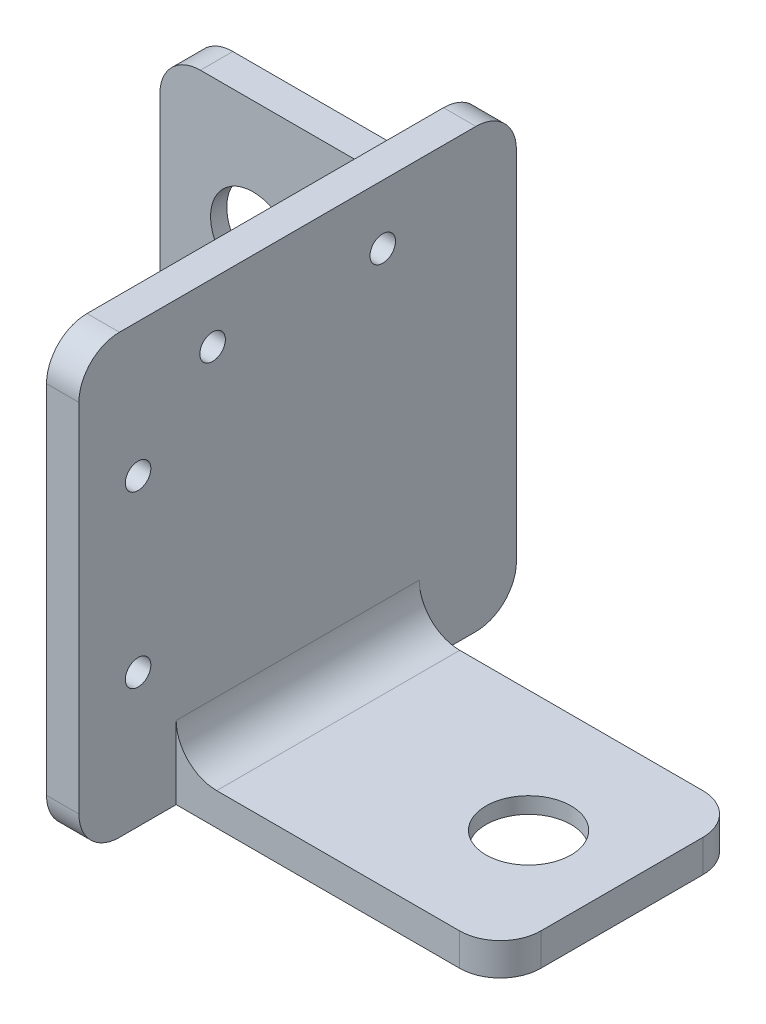
from build123d import *

# Parameters (mm, degrees)
SKETCH1_W            = 54
SKETCH1_H            = 54
BOSS_EXTRUDE1_DEPTH  = 4
FILLET1_R            = 5
SKETCH2_W            = 30
SKETCH2_H            = 4
BOSS_EXTRUDE2_DEPTH  = 3
SKETCH3_W            = 30
SKETCH3_H            = 4
BOSS_EXTRUDE3_DEPTH  = 37
SKETCH4_W            = 4
SKETCH4_H            = 30.000186299
BOSS_EXTRUDE6_DEPTH  = 3
SKETCH6_W            = 4
SKETCH6_H            = 30.000186299
BOSS_EXTRUDE7_DEPTH  = 33
FILLET2_R            = 5
SKETCH7_R            = 1.25
CUT_EXTRUDE1_DEPTH   = 75.706090782
SKETCH8_R            = 1.25
CUT_EXTRUDE2_DEPTH   = 75.706090782
SKETCH9_R            = 1.575
CUT_EXTRUDE3_DEPTH   = 56.299186251
SKETCH10_R           = 1.575
CUT_EXTRUDE4_DEPTH   = 56.299186251
FILLET6_R            = 5
SKETCH11_R           = 1.575
CUT_EXTRUDE5_DEPTH   = 59.258046655
SKETCH12_R           = 1.575
CUT_EXTRUDE6_DEPTH   = 33
BOSS_EXTRUDE10_DEPTH = 30
SKETCH15_R           = 11
CUT_EXTRUDE7_DEPTH   = 2
SKETCH16_R           = 5.25
CUT_EXTRUDE8_DEPTH   = 2
SKETCH17_R           = 11
CUT_EXTRUDE9_DEPTH   = 2
SKETCH18_R           = 5.25
CUT_EXTRUDE10_DEPTH  = 2


with BuildPart() as part:
    # Sketch1 → Boss-Extrude1 (new body)
    with BuildSketch(Plane(origin=(0, 0, 0), x_dir=(0, 0, -1), z_dir=(1, 0, 0))):
        Rectangle(SKETCH1_W, SKETCH1_H)
    extrude(amount=BOSS_EXTRUDE1_DEPTH)

    # Fillet1
    fillet1_edges = [part.edges().sort_by_distance(p)[0] for p in [
        (2, -27, -27),
        (2, -27, 27),
        (2, 27, 27),
        (2, 27, -27),
    ]]
    fillet(fillet1_edges, radius=FILLET1_R)

    # Sketch2 → Boss-Extrude2 (add)
    with BuildSketch(Plane(origin=(4, 0, 0), x_dir=(0, 0, -1), z_dir=(1, 0, 0))):
        with Locations((0.003473607, -25)):
            Rectangle(SKETCH2_W, SKETCH2_H)
    extrude(amount=BOSS_EXTRUDE2_DEPTH)

    # Sketch3 → Boss-Extrude3 (add)
    with BuildSketch(Plane(origin=(7, 0, 0), x_dir=(0, 0, -1), z_dir=(1, 0, 0))):
        with Locations((0.003473607, -25)):
            Rectangle(SKETCH3_W, SKETCH3_H)
    extrude(amount=BOSS_EXTRUDE3_DEPTH)

    # Sketch4 → Boss-Extrude6 (add)
    with BuildSketch(Plane.ZY):
        with Locations((-25, 0.003724222)):
            Rectangle(SKETCH4_W, SKETCH4_H)
    extrude(amount=BOSS_EXTRUDE6_DEPTH)

    # Sketch6 → Boss-Extrude7 (add)
    with BuildSketch(Plane.ZY.offset(3)):
        with Locations((-25, 0.003724222)):
            Rectangle(SKETCH6_W, SKETCH6_H)
    extrude(amount=BOSS_EXTRUDE7_DEPTH)

    # Fillet2
    fillet2_edges = [part.edges().sort_by_distance(p)[0] for p in [
        (44, -25, 14.996526393),
        (44, -25, -15.003473607),
        (-36, -14.996368927, -25),
        (-36, 15.003817372, -25),
    ]]
    fillet(fillet2_edges, radius=FILLET2_R)

    # Sketch7 → Cut-Extrude1 (cut, through all)
    with BuildSketch(Plane(origin=(0, 0, -27), x_dir=(-1, 0, 0), z_dir=(0, 0, -1))):
        with Locations((24.5, 0)):
            Circle(SKETCH7_R)
    extrude(amount=-CUT_EXTRUDE1_DEPTH, mode=Mode.SUBTRACT)

    # Sketch8 → Cut-Extrude2 (cut, through all)
    with BuildSketch(Plane(origin=(0, -27, 0), x_dir=(-1, 0, 0), z_dir=(0, -1, 0))):
        with Locations(Location((-32.5, 0, 0), (0, 0, 90))):
            Circle(SKETCH8_R)
    extrude(amount=-CUT_EXTRUDE2_DEPTH, mode=Mode.SUBTRACT)

    # Sketch9 → Cut-Extrude3 (cut, through all)
    with BuildSketch(Plane(origin=(4, 0, 0), x_dir=(0, 0, -1), z_dir=(1, 0, 0))):
        with Locations((-10.5, 19.7)):
            Circle(SKETCH9_R)
    extrude(amount=-CUT_EXTRUDE3_DEPTH, mode=Mode.SUBTRACT)

    # Sketch10 → Cut-Extrude4 (cut, through all)
    with BuildSketch(Plane(origin=(4, 0, 0), x_dir=(0, 0, -1), z_dir=(1, 0, 0))):
        with Locations((10.5, 19.7)):
            Circle(SKETCH10_R)
    extrude(amount=-CUT_EXTRUDE4_DEPTH, mode=Mode.SUBTRACT)

    # Fillet6
    fillet6_edges = [part.edges().sort_by_distance(p)[0] for p in [
        (4, -23, -0.003473607),
    ]]
    fillet(fillet6_edges, radius=FILLET6_R)

    # Sketch11 → Cut-Extrude5 (cut, through all)
    with BuildSketch(Plane.ZY):
        with Locations((19.7, 10.5)):
            Circle(SKETCH11_R)
    extrude(amount=-CUT_EXTRUDE5_DEPTH, mode=Mode.SUBTRACT)

    # Sketch12 → Cut-Extrude6 (cut)
    with BuildSketch(Plane.ZY):
        with Locations((19.7, -10.5)):
            Circle(SKETCH12_R)
    extrude(amount=-CUT_EXTRUDE6_DEPTH, mode=Mode.SUBTRACT)

    # Sketch14 → Boss-Extrude10 (add)
    with BuildSketch(Plane(origin=(0, -14.996368927, 0), x_dir=(-1, 0, 0), z_dir=(0, -1, 0))):
        with BuildLine():
            Line((6.771773058, 23), (0, 23))
            Line((0, 23), (0, 17.043091053))
            add(Edge.make_bspline(
                [(0, 17.043091053), (0.522042102, 20.003738935), (3.432344379, 22.411168624), (6.771773058, 23)],
                knots=[0, 0, 0, 0, 1, 1, 1, 1], degree=3))
        make_face()
    extrude(amount=-BOSS_EXTRUDE10_DEPTH)

    # Sketch15 → Cut-Extrude7 (cut)
    with BuildSketch(Plane(origin=(0, -27, 0), x_dir=(-1, 0, 0), z_dir=(0, -1, 0))):
        with Locations(Location((-32.5, 0, 0), (0, 0, 90))):
            Circle(SKETCH15_R)
    extrude(amount=-CUT_EXTRUDE7_DEPTH, mode=Mode.SUBTRACT)

    # Sketch16 → Cut-Extrude8 (cut)
    with BuildSketch(Plane(origin=(0, -23, 0), x_dir=(1, 0, 0), z_dir=(0, 1, 0))):
        with Locations(Location((32.5, 0, 0), (0, 0, 270))):
            Circle(SKETCH16_R)
    extrude(amount=-CUT_EXTRUDE8_DEPTH, mode=Mode.SUBTRACT)

    # Sketch17 → Cut-Extrude9 (cut)
    with BuildSketch(Plane(origin=(0, 0, -27), x_dir=(-1, 0, 0), z_dir=(0, 0, -1))):
        with Locations((24.5, 0)):
            Circle(SKETCH17_R)
    extrude(amount=-CUT_EXTRUDE9_DEPTH, mode=Mode.SUBTRACT)

    # Sketch18 → Cut-Extrude10 (cut)
    with BuildSketch(Plane.XY.offset(-23)):
        with Locations((-24.5, 0)):
            Circle(SKETCH18_R)
    extrude(amount=-CUT_EXTRUDE10_DEPTH, mode=Mode.SUBTRACT)


solid = part.part
